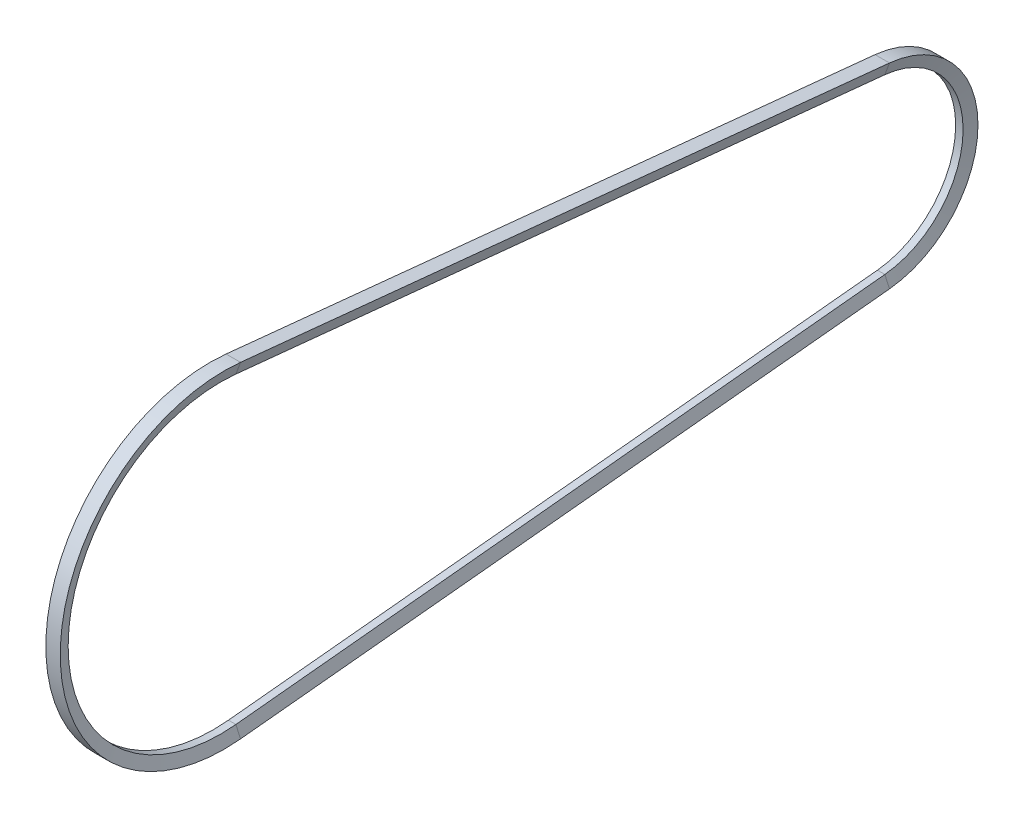
from build123d import *


with BuildPart() as part:
    # 扫描1: sweep along a path in 草图1
    with BuildLine(Plane(origin=(0, 0, 0), x_dir=(0, 0, -1), z_dir=(1, 0, 0))) as sweep_1_path:
        Line((12.5, 124.373429638), (507.5, 74.624057783))
        ThreePointArc((507.5, 74.624057783), (575, 0), (507.5, -74.624057783))
        Line((507.5, -74.624057783), (12.5, -124.373429638))
        ThreePointArc((12.5, -124.373429638), (-125, 0), (12.5, 124.373429638))
    # 草图2 → 扫描1 (sweep)
    with BuildSketch(Plane.XY):
        Polygon((-5.5, 125), (5.5, 125), (2.840143071, 116.3), (-2.840143071, 116.3), align=None)
    sweep(path=sweep_1_path.line)


solid = part.part
